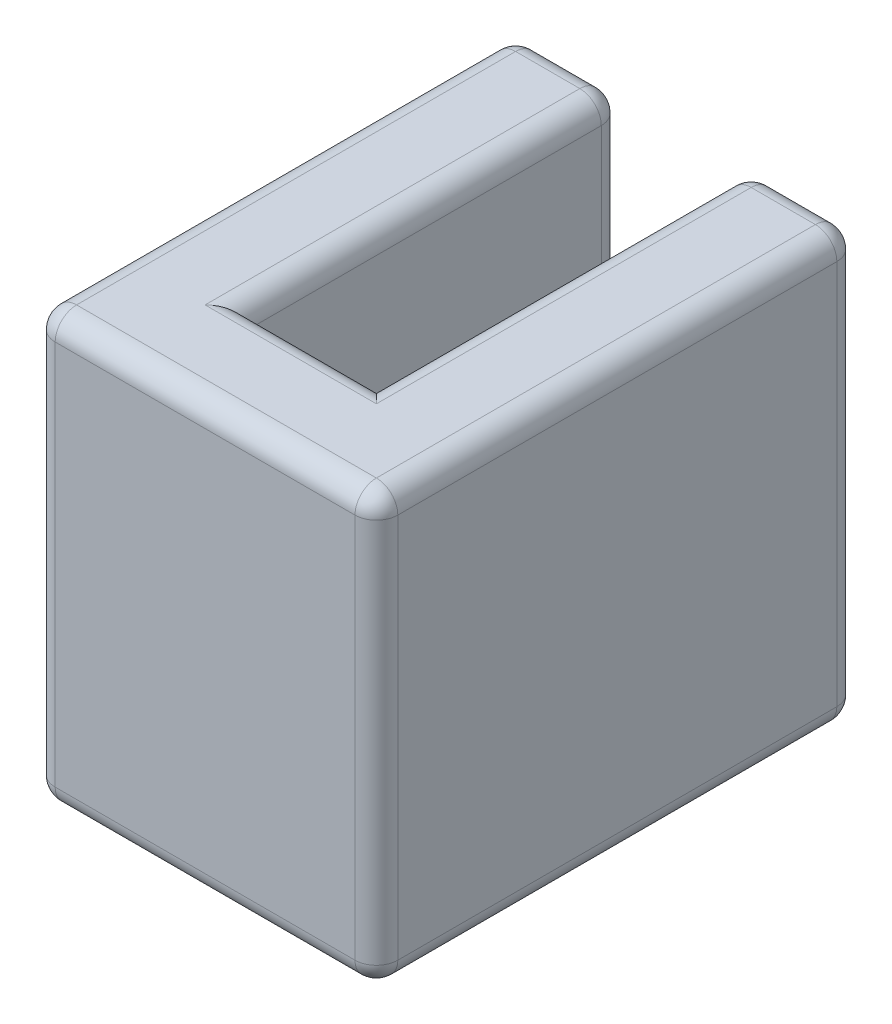
from build123d import *

# Parameters (mm, degrees)
BOSS_EXTRUDE1_DEPTH = 8
FILLET1_R           = 0.4


with BuildPart() as part:
    # Sketch1 → Boss-Extrude1 (new body)
    with BuildSketch(Plane(origin=(0, 0, 0), x_dir=(1, 0, 0), z_dir=(0, 1, 0))):
        Polygon((0, 0), (-6.4, 0), (-6.4, 9), (-4.4, 9), (-4.4, 2), (-2, 2), (-2, 9), (0, 9), align=None)
    extrude(amount=BOSS_EXTRUDE1_DEPTH)

    # Fillet1
    fillet1_edges = [part.edges().sort_by_distance(p)[0] for p in [
        (-3.2, 0, -2),
        (-2, 0, -5.5),
        (-1, 0, -9),
        (0, 0, -4.5),
        (-2, 8, -5.5),
        (0, 4, 0),
        (-6.4, 4, 0),
        (-6.4, 4, -9),
        (-4.4, 4, -9),
        (-2, 4, -9),
        (0, 4, -9),
        (-3.2, 8, -2),
        (-4.4, 8, -5.5),
        (-5.4, 8, -9),
        (-6.4, 8, -4.5),
        (-3.2, 8, 0),
        (0, 8, -4.5),
        (-3.2, 0, 0),
        (-1, 8, -9),
        (-6.4, 0, -4.5),
        (-5.4, 0, -9),
        (-4.4, 0, -5.5),
    ]]
    fillet(fillet1_edges, radius=FILLET1_R)


solid = part.part
